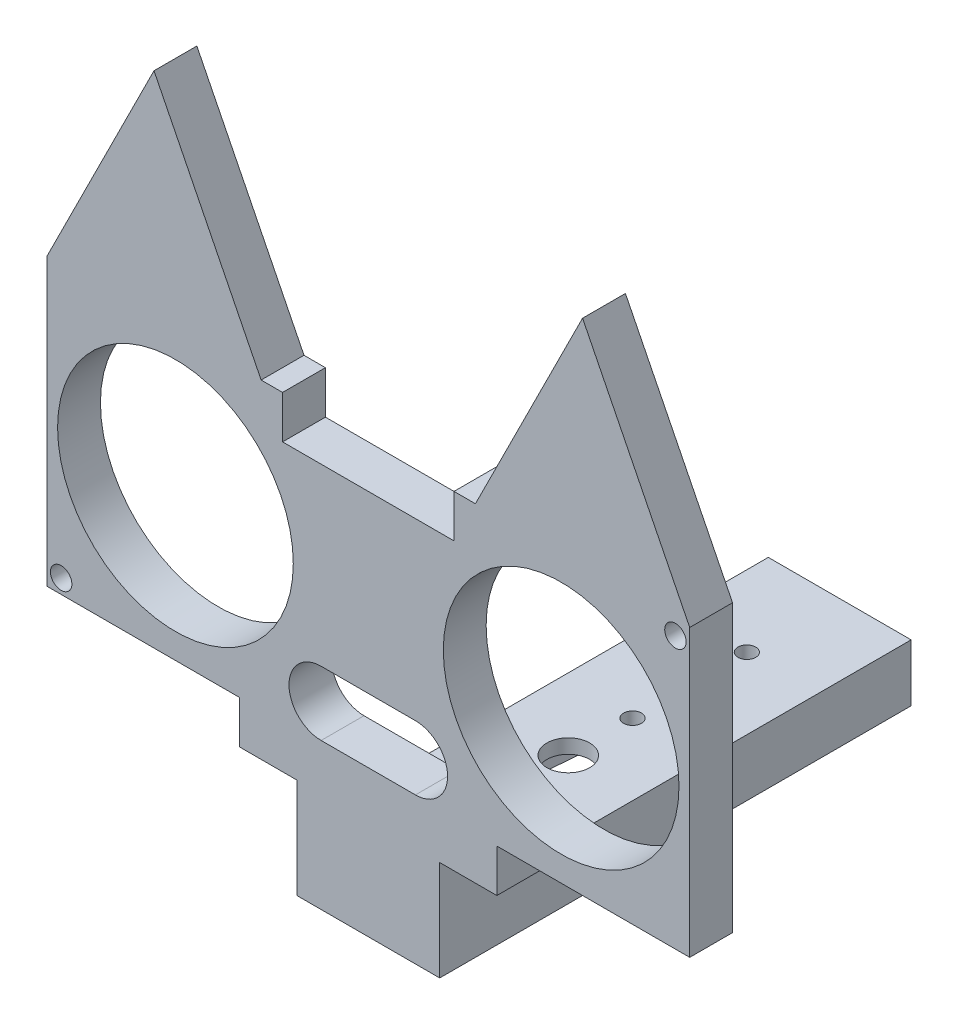
from build123d import *

# Parameters (mm, degrees)
SKETCH1_W               = 45
SKETCH1_H               = 20
BOSS_EXTRUDE1_DEPTH     = 3
CUT_EXTRUDE1_DEPTH      = 25.80423351
CUT_EXTRUDE1_DEPTH_BACK = 25.80423351
SKETCH2_R               = 8.25
SKETCH2_R_2             = 0.75
BOSS_EXTRUDE2_DEPTH     = 3
BOSS_EXTRUDE3_DEPTH     = 3
SKETCH9_W               = 10
SKETCH9_H               = 4
BOSS_EXTRUDE4_DEPTH     = 30
CUT_EXTRUDE2_DEPTH      = 3
CUT_EXTRUDE3_DEPTH      = 56.563027275
CUT_EXTRUDE3_DEPTH_BACK = 56.563027275
SKETCH11_R              = 0.625
SKETCH11_R_2            = 1.5
CUT_EXTRUDE4_DEPTH      = 48.11952886
CUT_EXTRUDE4_DEPTH_BACK = 48.11952886
SKETCH12_W              = 12
SKETCH12_H              = 3


with BuildPart() as part:
    # Sketch1 → Boss-Extrude1 (new body)
    with BuildSketch(Plane.XY):
        Rectangle(SKETCH1_W, SKETCH1_H)
    extrude(amount=BOSS_EXTRUDE1_DEPTH)

    # Sketch2 → Cut-Extrude1 (cut, two sides: drawn at the far end of the back side and taken through both)
    with BuildSketch(Plane.XY.offset(3).offset(-CUT_EXTRUDE1_DEPTH_BACK)):
        with Locations((-13.5, 0)):
            Circle(SKETCH2_R)
        with Locations(Location((13.5, 0, 0), (0, 0, 180))):
            Circle(SKETCH2_R)
        with Locations((-21.5, -9)):
            Circle(SKETCH2_R_2)
        with Locations((21.5, 9)):
            Circle(SKETCH2_R_2)
    extrude(amount=CUT_EXTRUDE1_DEPTH + CUT_EXTRUDE1_DEPTH_BACK, mode=Mode.SUBTRACT)

    # Sketch7 → Boss-Extrude2 (add)
    with BuildSketch(Plane.XY.offset(3)):
        Polygon((-15, 25), (-22.5, 10), (-7.5, 10), align=None)
        Polygon((15, 25), (7.5, 10), (22.5, 10), align=None)
    extrude(amount=-BOSS_EXTRUDE2_DEPTH)

    # Sketch8 → Boss-Extrude3 (add)
    with BuildSketch(Plane.XY.offset(3)):
        Polygon((-5, -13), (-5, -20), (5, -20), (5, -13), (9, -13), (9, -10), (-9, -10), (-9, -13), align=None)
    extrude(amount=-BOSS_EXTRUDE3_DEPTH)

    # Sketch9 → Boss-Extrude4 (add)
    with BuildSketch(Plane(origin=(0, 0, 0), x_dir=(-1, 0, 0), z_dir=(0, 0, -1))):
        with Locations((0, -18)):
            Rectangle(SKETCH9_W, SKETCH9_H)
    extrude(amount=BOSS_EXTRUDE4_DEPTH)

    # Sketch10 → Cut-Extrude2 (cut)
    with BuildSketch(Plane.XZ.offset(20)):
        with BuildLine():
            Line((-4, -11), (-3, -24))
            ThreePointArc((-3, -24), (0, -27), (3, -24))
            Line((3, -24), (4, -11))
            ThreePointArc((4, -11), (0, -7), (-4, -11))
        make_face()
    extrude(amount=-CUT_EXTRUDE2_DEPTH, mode=Mode.SUBTRACT)

    # Sketch11 → Cut-Extrude3 (cut, two sides: drawn at the far end of the back side and taken through both)
    with BuildSketch(Plane(origin=(0, -16, 0), x_dir=(1, 0, 0), z_dir=(0, 1, 0)).offset(-CUT_EXTRUDE3_DEPTH_BACK)):
        with Locations(Location((0, 15.5, 0), (0, 0, 90))):
            Circle(SKETCH11_R)
        with Locations(Location((0, 19.5, 0), (0, 0, 90))):
            Circle(SKETCH11_R)
        with Locations(Location((0, 11, 0), (0, 0, 90))):
            Circle(SKETCH11_R_2)
        with Locations(Location((0, 23.5, 0), (0, 0, 90))):
            Circle(SKETCH11_R)
    extrude(amount=CUT_EXTRUDE3_DEPTH + CUT_EXTRUDE3_DEPTH_BACK, mode=Mode.SUBTRACT)

    # Sketch12 → Cut-Extrude4 (cut, two sides: drawn at the far end of the back side and taken through both)
    with BuildSketch(Plane.XY.offset(3).offset(-CUT_EXTRUDE4_DEPTH_BACK)):
        with BuildLine():
            Line((-3.3, -5.25), (3.3, -5.25))
            ThreePointArc((3.3, -5.25), (5.55, -7.5), (3.3, -9.75))
            Line((3.3, -9.75), (-3.3, -9.75))
            ThreePointArc((-3.3, -9.75), (-5.55, -7.5), (-3.3, -5.25))
        make_face()
        with Locations((0, 8.5)):
            Rectangle(SKETCH12_W, SKETCH12_H)
    extrude(amount=CUT_EXTRUDE4_DEPTH + CUT_EXTRUDE4_DEPTH_BACK, mode=Mode.SUBTRACT)


solid = part.part
